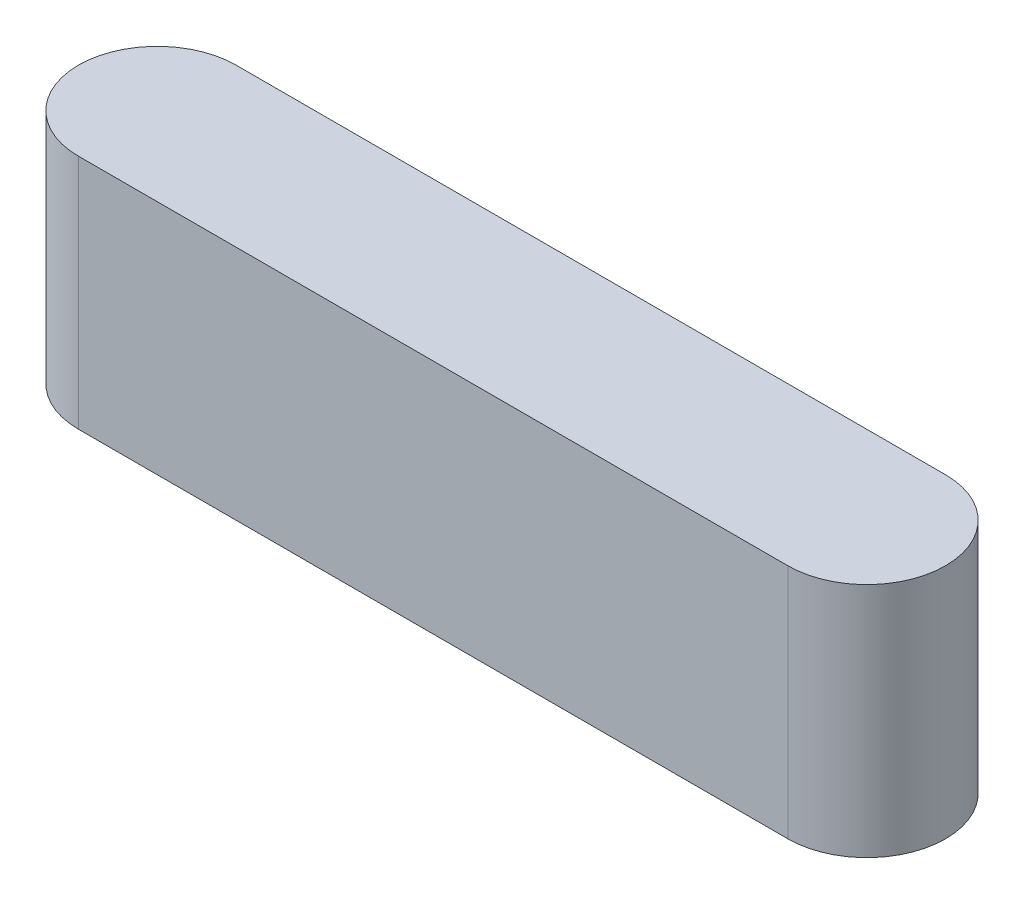
from build123d import *

# Parameters (mm, degrees)
BOSS_EXTRUDE1_DEPTH = 7.5


with BuildPart() as part:
    # Sketch1 → Boss-Extrude1 (new, symmetric)
    with BuildSketch(Plane(origin=(0, 0, 0), x_dir=(1, 0, 0), z_dir=(0, 1, 0))):
        with BuildLine():
            Line((-22.5, -5), (22.5, -5))
            ThreePointArc((22.5, -5), (27.5, 0), (22.5, 5))
            Line((22.5, 5), (-22.5, 5))
            ThreePointArc((-22.5, 5), (-27.5, 0), (-22.5, -5))
        make_face()
    extrude(amount=BOSS_EXTRUDE1_DEPTH, both=True)


solid = part.part
